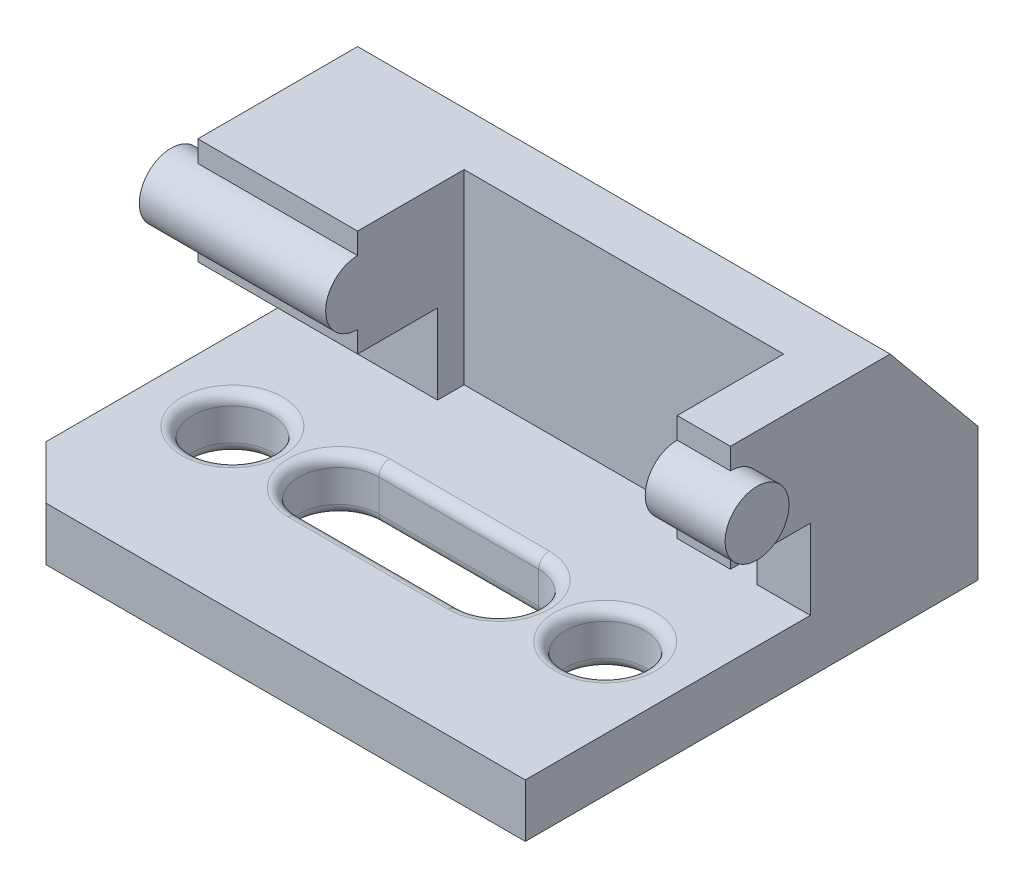
from build123d import *

# Parameters (mm, degrees)
BOSS_EXTRUDE1_DEPTH = 10
SKETCH2_R           = 7.5
CUT_EXTRUDE1_DEPTH  = 10
BOSS_EXTRUDE2_DEPTH = 100
BOSS_EXTRUDE3_START = 5
SKETCH4_R           = 6
BOSS_EXTRUDE3_DEPTH = 110
SKETCH5_R           = 7.5
CUT_EXTRUDE2_DEPTH  = 20
CUT_EXTRUDE3_REACH  = 84.802
SKETCH6_W           = 60
SKETCH6_H           = 36.196547207
FILLET1_R           = 2


with BuildPart() as part:
    # Sketch1 → Boss-Extrude1 (new body)
    with BuildSketch(Plane(origin=(0, 0, 0), x_dir=(1, 0, 0), z_dir=(0, 1, 0))):
        Polygon((-50, -32.5), (-40, -42.5), (50, -42.5), (50, 42.5), (-50, 42.5), align=None)
    extrude(amount=BOSS_EXTRUDE1_DEPTH)

    # Sketch2 → Cut-Extrude1 (cut)
    with BuildSketch(Plane(origin=(0, 10, 0), x_dir=(1, 0, 0), z_dir=(0, 1, 0))):
        with Locations(Location((-35, -12.5, 0), (0, 0, 270))):
            Circle(SKETCH2_R)
        with Locations(Location((35, -12.5, 0), (0, 0, 270))):
            Circle(SKETCH2_R)
        with BuildLine():
            Line((15, -5), (-15, -5))
            ThreePointArc((-15, -5), (-22.5, -12.5), (-15, -20))
            Line((-15, -20), (15, -20))
            ThreePointArc((15, -20), (22.5, -12.5), (15, -5))
        make_face()
    extrude(amount=-CUT_EXTRUDE1_DEPTH, mode=Mode.SUBTRACT)

    # Sketch3 → Boss-Extrude2 (add)
    with BuildSketch(Plane.ZY.offset(50)):
        Polygon((-42.5, 10), (-42.5, 25), (-26.013272284, 45), (3.986727716, 45), (3.986727716, 25), (-11.013272284, 25), (-11.013272284, 10), align=None)
    extrude(amount=-BOSS_EXTRUDE2_DEPTH)

    # Sketch4 → Boss-Extrude3 (add)
    with BuildSketch(Plane.ZY.offset(50).offset(BOSS_EXTRUDE3_START)):
        with Locations((3.986727716, 35)):
            Circle(SKETCH4_R)
    extrude(amount=-BOSS_EXTRUDE3_DEPTH)

    # Sketch5 → Cut-Extrude2 (cut)
    with BuildSketch(Plane(origin=(0, 30.974465206, -37.575030945), x_dir=(1, 0, 0), z_dir=(0, 0.636078220277765, -0.7716245833877192))):
        with Locations((-50, -5.216960269)):
            Circle(SKETCH5_R)
    extrude(amount=-CUT_EXTRUDE2_DEPTH, mode=Mode.SUBTRACT)

    # Cut-Extrude3: up to this face of the body (flat: up to its plane)
    cut_extrude3_end = Plane(part.part.faces().sort_by_distance((-48.865818784, 10, 10.743363858))[0])
    # Sketch6 → Cut-Extrude3 (cut, up to the picked face)
    with BuildSketch(Plane(origin=(0, 45, 0), x_dir=(1, 0, 0), z_dir=(0, 1, 0)), mode=Mode.PRIVATE) as cut_extrude3_sk1:
        with Locations((10, -2.08500132)):
            Rectangle(SKETCH6_W, SKETCH6_H)
    cut_extrude3_tool1 = split(extrude(cut_extrude3_sk1.sketch, amount=-CUT_EXTRUDE3_REACH, mode=Mode.PRIVATE), bisect_by=cut_extrude3_end, keep=Keep.BOTH, mode=Mode.PRIVATE)
    add(cut_extrude3_tool1.solids().sort_by(Axis((10, 45, 2.085001), (0, -1, 0)))[0], mode=Mode.SUBTRACT)

    # Fillet1
    fillet1_edges = [part.edges().sort_by_distance(p)[0] for p in [
        (-35, 0, 5),
        (-35, 10, 5),
        (35, 0, 5),
        (35, 10, 5),
        (-22.5, 0, 12.5),
        (0, 0, 5),
        (22.5, 0, 12.5),
        (0, 0, 20),
        (-22.5, 10, 12.5),
        (0, 10, 20),
        (22.5, 10, 12.5),
        (0, 10, 5),
    ]]
    fillet(fillet1_edges, radius=FILLET1_R)


solid = part.part
